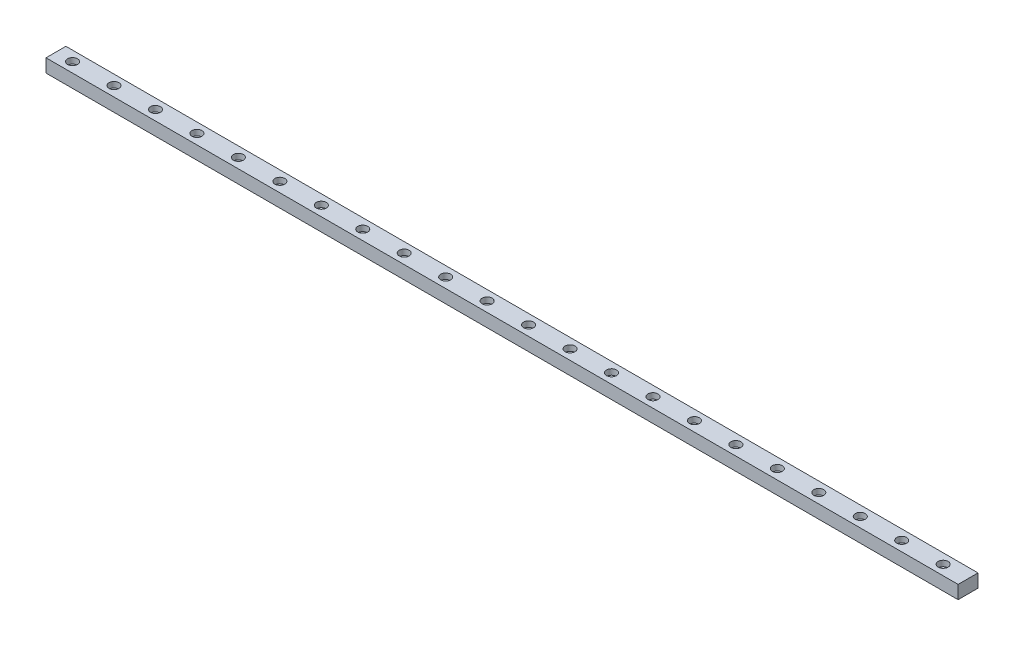
from build123d import *

# Parameters (mm, degrees)
SKETCH_1_W                   = 12
SKETCH_1_H                   = 8
EXTRUDE_1_DEPTH              = 550
HOLE_WIZARD_M3_1_D           = 3.2
HOLE_WIZARD_M3_1_CBORE_D     = 6
HOLE_WIZARD_M3_1_CBORE_DEPTH = 3.4
PATTERN_LINEAR_1_COUNT       = 22
PATTERN_LINEAR_1_PITCH       = 25


with BuildPart() as part:
    # 草圖1 → 伸長1 (new body)
    with BuildSketch(Plane(origin=(0, 0, 0), x_dir=(0, 0, -1), z_dir=(1, 0, 0))):
        with Locations((0, 4)):
            Rectangle(SKETCH_1_W, SKETCH_1_H)
    extrude(amount=EXTRUDE_1_DEPTH)

    # M3 內六角圓柱頭螺釘的柱孔1 (through all)
    with Locations(Plane(origin=(10, 8, 0), x_dir=(0, 0, 1), z_dir=(0, 1, 0))):
        with Locations((0, 0)):
            hole_wizard_m3_1 = CounterBoreHole(HOLE_WIZARD_M3_1_D / 2, HOLE_WIZARD_M3_1_CBORE_D / 2, HOLE_WIZARD_M3_1_CBORE_DEPTH)

    # 直線複製排列1: M3 內六角圓柱頭螺釘的柱孔1 ×22
    with Locations(*[(i * PATTERN_LINEAR_1_PITCH, 0, 0) for i in range(1, PATTERN_LINEAR_1_COUNT)]):
        add(hole_wizard_m3_1, mode=Mode.SUBTRACT)


solid = part.part
